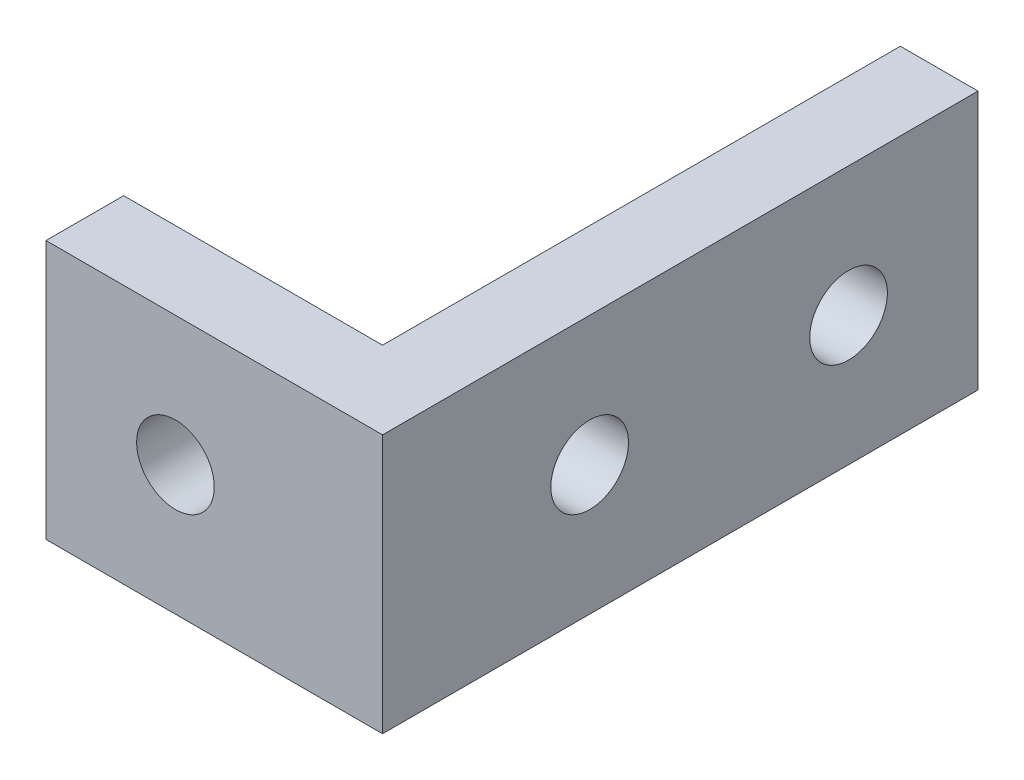
from build123d import *

# Parameters (mm, degrees)
EXTRUDE_1_DEPTH     = 10
SKETCH_2_R          = 1.5
CUT_EXTRUDE_1_DEPTH = 10
SKETCH_3_R          = 1.5
CUT_EXTRUDE_2_DEPTH = 10


with BuildPart() as part:
    # 草图1 → 凸台-拉伸1 (new body)
    with BuildSketch(Plane(origin=(0, 0, 0), x_dir=(1, 0, 0), z_dir=(0, 1, 0))):
        Polygon((-13, 0), (0, 0), (0, 23), (-3, 23), (-3, 3), (-13, 3), align=None)
    extrude(amount=EXTRUDE_1_DEPTH)

    # 草图2 → 切除-拉伸1 (cut)
    with BuildSketch(Plane.ZY.offset(3)):
        with Locations((-18, 5)):
            Circle(SKETCH_2_R)
        with Locations((-8, 5)):
            Circle(SKETCH_2_R)
    extrude(amount=-CUT_EXTRUDE_1_DEPTH, mode=Mode.SUBTRACT)

    # 草图3 → 切除-拉伸2 (cut)
    with BuildSketch(Plane(origin=(0, 0, -3), x_dir=(-1, 0, 0), z_dir=(0, 0, -1))):
        with Locations((8, 5)):
            Circle(SKETCH_3_R)
        with Locations((-2, 5)):
            Circle(SKETCH_3_R)
    extrude(amount=-CUT_EXTRUDE_2_DEPTH, mode=Mode.SUBTRACT)


solid = part.part
